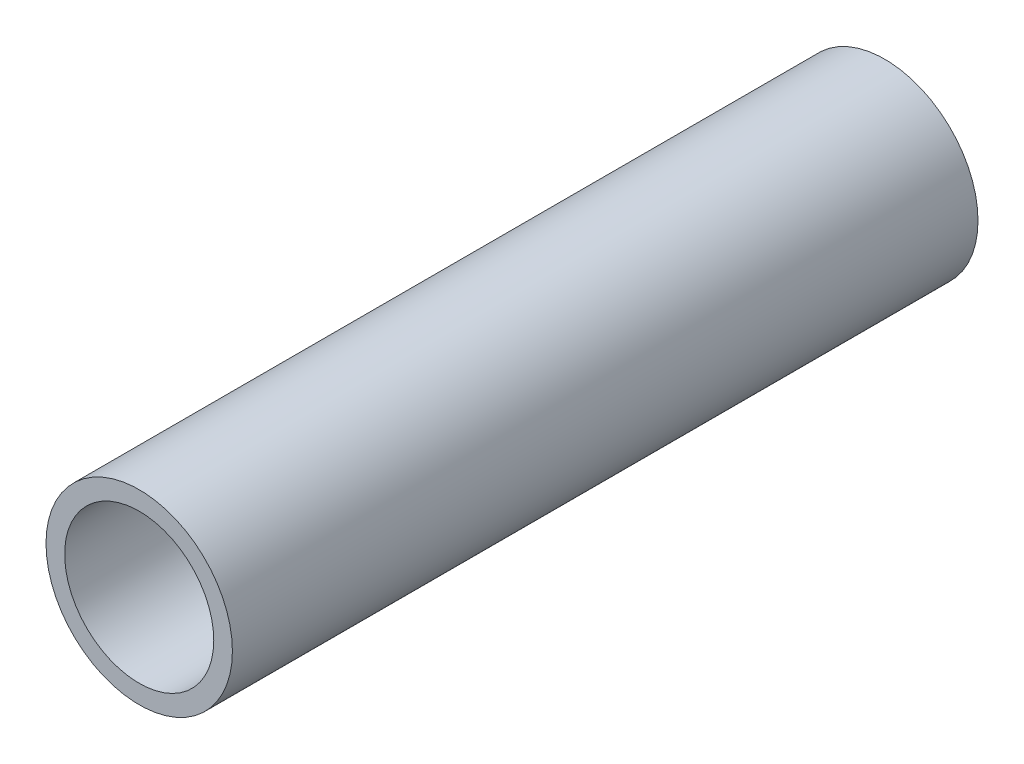
from build123d import *

# Parameters (mm, degrees)
SKETCH1_R           = 25
SKETCH1_R_2         = 20
BOSS_EXTRUDE1_DEPTH = 200


with BuildPart() as part:
    # Sketch1 → Boss-Extrude1 (new body)
    with BuildSketch(Plane.XY):
        Circle(SKETCH1_R)
        Circle(SKETCH1_R_2, mode=Mode.SUBTRACT)
    extrude(amount=BOSS_EXTRUDE1_DEPTH)


solid = part.part
